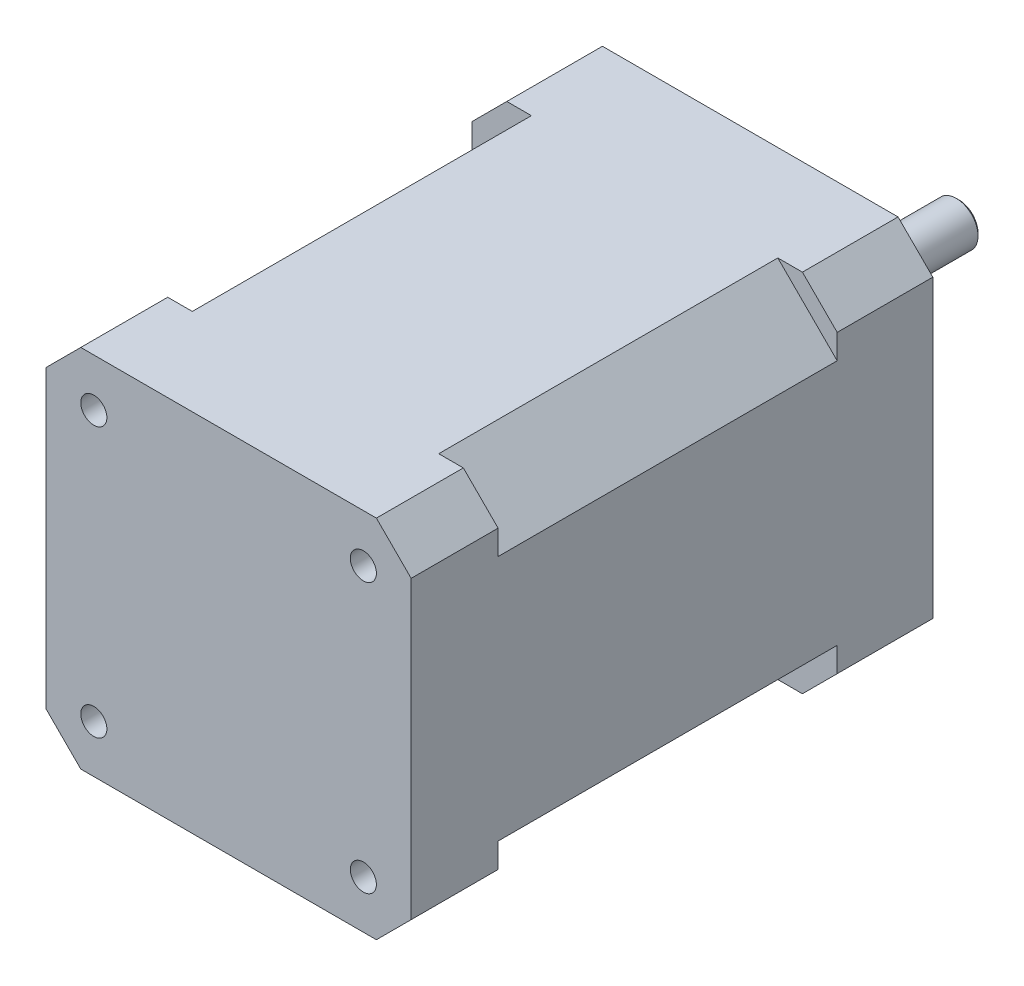
from build123d import *

# Parameters (mm, degrees)
SKETCH_1_W          = 42
SKETCH_1_H          = 42
EXTRUDE_1_DEPTH     = 60
SKETCH_2_R          = 1.5
CUT_EXTRUDE_1_DEPTH = 65
SKETCH_3_R          = 11
EXTRUDE_2_DEPTH     = 2
SKETCH_4_R          = 2.5
EXTRUDE_3_DEPTH     = 22
CHAMFER_1_SIZE      = 0.3
CHAMFER_2_SIZE      = 4
CUT_EXTRUDE_2_DEPTH = 39


with BuildPart() as part:
    # Эскиз1 → Бобышка-Вытянуть1 (new body)
    with BuildSketch(Plane.XY):
        with Locations((-12.492530381, 4.702380952)):
            Rectangle(SKETCH_1_W, SKETCH_1_H)
    extrude(amount=EXTRUDE_1_DEPTH)

    # Эскиз2 → Вырез-Вытянуть1 (cut)
    with BuildSketch(Plane(origin=(0, 0, 0), x_dir=(-1, 0, 0), z_dir=(0, 0, -1))):
        with Locations((-3.007469619, 20.202380952)):
            Circle(SKETCH_2_R)
        with Locations((27.992530381, 20.202380952)):
            Circle(SKETCH_2_R)
        with Locations((27.992530381, -10.797619048)):
            Circle(SKETCH_2_R)
        with Locations((-3.007469619, -10.797619048)):
            Circle(SKETCH_2_R)
    extrude(amount=-CUT_EXTRUDE_1_DEPTH, mode=Mode.SUBTRACT)

    # Эскиз3 → Бобышка-Вытянуть2 (add)
    with BuildSketch(Plane(origin=(0, 0, 0), x_dir=(-1, 0, 0), z_dir=(0, 0, -1))):
        with Locations(Location((12.492530381, 4.702380952, 0), (0, 0, 180))):
            Circle(SKETCH_3_R)
    extrude(amount=EXTRUDE_2_DEPTH)

    # Эскиз4 → Бобышка-Вытянуть3 (add)
    with BuildSketch(Plane(origin=(0, 0, -2), x_dir=(-1, 0, 0), z_dir=(0, 0, -1))):
        with Locations((12.492530381, 4.702380952)):
            Circle(SKETCH_4_R)
    extrude(amount=EXTRUDE_3_DEPTH)

    # Фаска1
    chamfer_1_edges = [part.edges().sort_by_distance(p)[0] for p in [
        (-9.992530381, 4.702380952, -24),
    ]]
    chamfer(chamfer_1_edges, length=CHAMFER_1_SIZE)

    # Фаска2
    chamfer_2_edges = [part.edges().sort_by_distance(p)[0] for p in [
        (-33.492530381, 25.702380952, 30),
        (8.507469619, 25.702380952, 30),
        (8.507469619, -16.297619048, 30),
        (-33.492530381, -16.297619048, 30),
    ]]
    chamfer(chamfer_2_edges, length=CHAMFER_2_SIZE)

    # Эскиз5 → Вырез-Вытянуть2 (cut)
    with BuildSketch(Plane(origin=(0, 0, 11), x_dir=(-1, 0, 0), z_dir=(0, 0, -1))):
        Polygon((-8.507469619, 18.873953828), (-1.679042494, 25.702380952), (-4.507469619, 25.702380952), (-8.507469619, 21.702380952), align=None)
        Polygon((-8.507469619, -9.469191923), (-8.507469619, -12.297619048), (-4.507469619, -16.297619048), (-1.679042494, -16.297619048), align=None)
        Polygon((26.664103256, 25.702380952), (33.492530381, 18.873953828), (33.492530381, 21.702380952), (29.492530381, 25.702380952), align=None)
        Polygon((33.492530381, -9.469191923), (26.664103256, -16.297619048), (29.492530381, -16.297619048), (33.492530381, -12.297619048), align=None)
    extrude(amount=-CUT_EXTRUDE_2_DEPTH, mode=Mode.SUBTRACT)


solid = part.part
